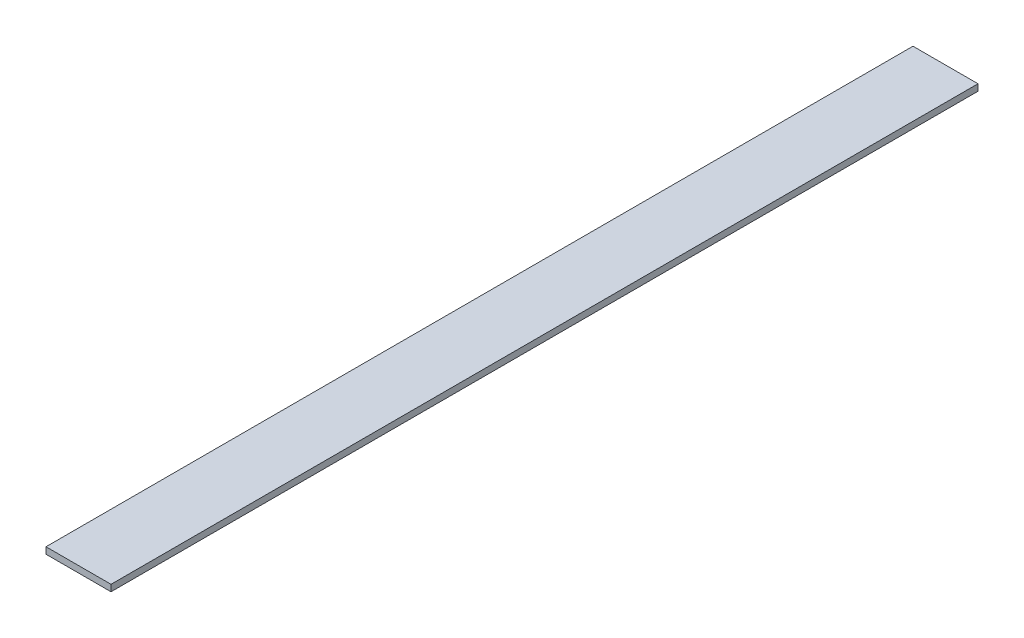
from build123d import *

# Parameters (mm, degrees)
SKETCH1_W           = 30
SKETCH1_H           = 400
BOSS_EXTRUDE1_DEPTH = 3


with BuildPart() as part:
    # Sketch1 → Boss-Extrude1 (new body)
    with BuildSketch(Plane(origin=(0, 0, 0), x_dir=(1, 0, 0), z_dir=(0, 1, 0))):
        with Locations((-21.516129032, 112.756272401)):
            Rectangle(SKETCH1_W, SKETCH1_H)
    extrude(amount=BOSS_EXTRUDE1_DEPTH)


solid = part.part
